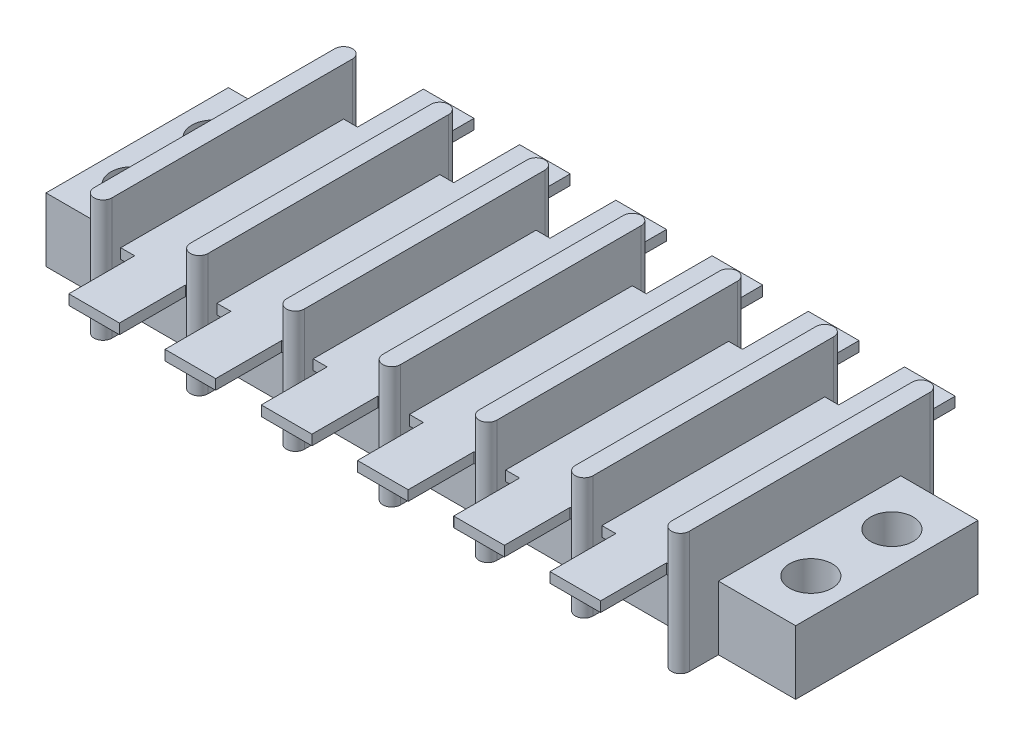
from build123d import *

# Parameters (mm, degrees)
SKETCH1_W           = 74
SKETCH1_H           = 18
BOSS_EXTRUDE1_DEPTH = 6.3
BOSS_EXTRUDE2_DEPTH = 12
BOSS_EXTRUDE3_DEPTH = 1
SKETCH6_R           = 2.1
CUT_EXTRUDE1_DEPTH  = 42.411834057


with BuildPart() as part:
    # Sketch1 → Boss-Extrude1 (new body)
    with BuildSketch(Plane(origin=(0, 0, 0), x_dir=(1, 0, 0), z_dir=(0, 1, 0))):
        Rectangle(SKETCH1_W, SKETCH1_H)
    extrude(amount=BOSS_EXTRUDE1_DEPTH)

    # Sketch4 → Boss-Extrude2 (add)
    with BuildSketch(Plane(origin=(0, 0, 0), x_dir=(1, 0, 0), z_dir=(0, 1, 0))):
        with BuildLine():
            Line((-27.625, 11.875), (-27.625, -11.875))
            ThreePointArc((-27.625, -11.875), (-28.5, -12.75), (-29.375, -11.875))
            Line((-29.375, -11.875), (-29.375, 11.875))
            ThreePointArc((-29.375, 11.875), (-28.5, 12.75), (-27.625, 11.875))
        make_face()
        with BuildLine():
            Line((-18.125, 11.875), (-18.125, -11.875))
            ThreePointArc((-18.125, -11.875), (-19, -12.75), (-19.875, -11.875))
            Line((-19.875, -11.875), (-19.875, 11.875))
            ThreePointArc((-19.875, 11.875), (-19, 12.75), (-18.125, 11.875))
        make_face()
        with BuildLine():
            Line((-8.625, 11.875), (-8.625, -11.875))
            ThreePointArc((-8.625, -11.875), (-9.5, -12.75), (-10.375, -11.875))
            Line((-10.375, -11.875), (-10.375, 11.875))
            ThreePointArc((-10.375, 11.875), (-9.5, 12.75), (-8.625, 11.875))
        make_face()
        with BuildLine():
            Line((0.875, 11.875), (0.875, -11.875))
            ThreePointArc((0.875, -11.875), (0, -12.75), (-0.875, -11.875))
            Line((-0.875, -11.875), (-0.875, 11.875))
            ThreePointArc((-0.875, 11.875), (0, 12.75), (0.875, 11.875))
        make_face()
        with BuildLine():
            Line((10.375, 11.875), (10.375, -11.875))
            ThreePointArc((10.375, -11.875), (9.5, -12.75), (8.625, -11.875))
            Line((8.625, -11.875), (8.625, 11.875))
            ThreePointArc((8.625, 11.875), (9.5, 12.75), (10.375, 11.875))
        make_face()
        with BuildLine():
            Line((19.875, 11.875), (19.875, -11.875))
            ThreePointArc((19.875, -11.875), (19, -12.75), (18.125, -11.875))
            Line((18.125, -11.875), (18.125, 11.875))
            ThreePointArc((18.125, 11.875), (19, 12.75), (19.875, 11.875))
        make_face()
        with BuildLine():
            Line((29.375, 11.875), (29.375, -11.875))
            ThreePointArc((29.375, -11.875), (28.5, -12.75), (27.625, -11.875))
            Line((27.625, -11.875), (27.625, 11.875))
            ThreePointArc((27.625, 11.875), (28.5, 12.75), (29.375, 11.875))
        make_face()
    extrude(amount=BOSS_EXTRUDE2_DEPTH)

    # Sketch5 → Boss-Extrude3 (add)
    with BuildSketch(Plane(origin=(0, 6.3, 0), x_dir=(1, 0, 0), z_dir=(0, 1, 0))):
        Polygon((-27.625, 11), (-26.25, 11), (-26.25, 17.5), (-21.25, 17.5), (-21.25, 11), (-19.875, 11), (-19.875, -11), (-21.25, -11), (-21.25, -17.5), (-26.25, -17.5), (-26.25, -11), (-27.625, -11), align=None)
        Polygon((-18.125, 11), (-16.75, 11), (-16.75, 17.5), (-11.75, 17.5), (-11.75, 11), (-10.375, 11), (-10.375, -11), (-11.75, -11), (-11.75, -17.5), (-16.75, -17.5), (-16.75, -11), (-18.125, -11), align=None)
        Polygon((-8.625, 11), (-7.25, 11), (-7.25, 17.5), (-2.25, 17.5), (-2.25, 11), (-0.875, 11), (-0.875, -11), (-2.25, -11), (-2.25, -17.5), (-7.25, -17.5), (-7.25, -11), (-8.625, -11), align=None)
        Polygon((0.875, 11), (2.25, 11), (2.25, 17.5), (7.25, 17.5), (7.25, 11), (8.625, 11), (8.625, -11), (7.25, -11), (7.25, -17.5), (2.25, -17.5), (2.25, -11), (0.875, -11), align=None)
        Polygon((10.375, 11), (11.75, 11), (11.75, 17.5), (16.75, 17.5), (16.75, 11), (18.125, 11), (18.125, -11), (16.75, -11), (16.75, -17.5), (11.75, -17.5), (11.75, -11), (10.375, -11), align=None)
        Polygon((19.875, 11), (21.25, 11), (21.25, 17.5), (26.25, 17.5), (26.25, 11), (27.625, 11), (27.625, -11), (26.25, -11), (26.25, -17.5), (21.25, -17.5), (21.25, -11), (19.875, -11), align=None)
    extrude(amount=BOSS_EXTRUDE3_DEPTH)

    # Sketch6 → Cut-Extrude1 (cut, through all)
    with BuildSketch(Plane(origin=(0, 6.3, 0), x_dir=(1, 0, 0), z_dir=(0, 1, 0))):
        with Locations(Location((-33.5, 4, 0), (0, 0, 270))):
            Circle(SKETCH6_R)
        with Locations(Location((-33.5, -4, 0), (0, 0, 270))):
            Circle(SKETCH6_R)
        with Locations(Location((33.5, 4, 0), (0, 0, 270))):
            Circle(SKETCH6_R)
        with Locations(Location((33.5, -4, 0), (0, 0, 270))):
            Circle(SKETCH6_R)
    extrude(amount=-CUT_EXTRUDE1_DEPTH, mode=Mode.SUBTRACT)


solid = part.part
